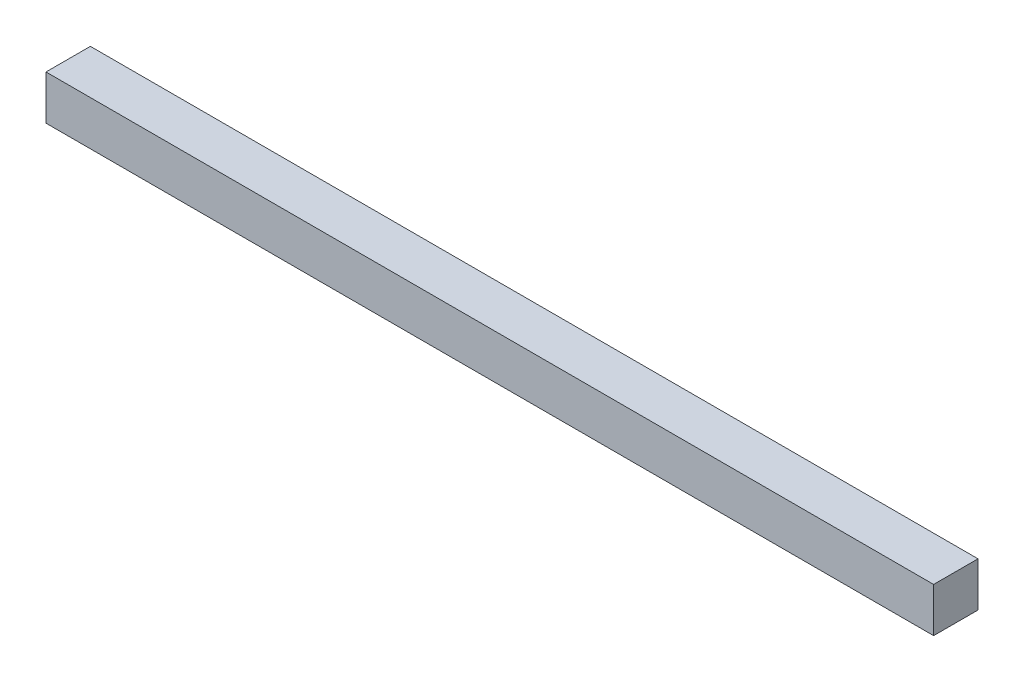
from build123d import *

# Parameters (mm, degrees)
SKETCH1_W           = 25.4
SKETCH1_H           = 25.4
BOSS_EXTRUDE1_DEPTH = 508


with BuildPart() as part:
    # Sketch1 → Boss-Extrude1 (new body)
    with BuildSketch(Plane(origin=(0, 0, 0), x_dir=(0, 0, -1), z_dir=(1, 0, 0))):
        Rectangle(SKETCH1_W, SKETCH1_H)
    extrude(amount=BOSS_EXTRUDE1_DEPTH)


solid = part.part
